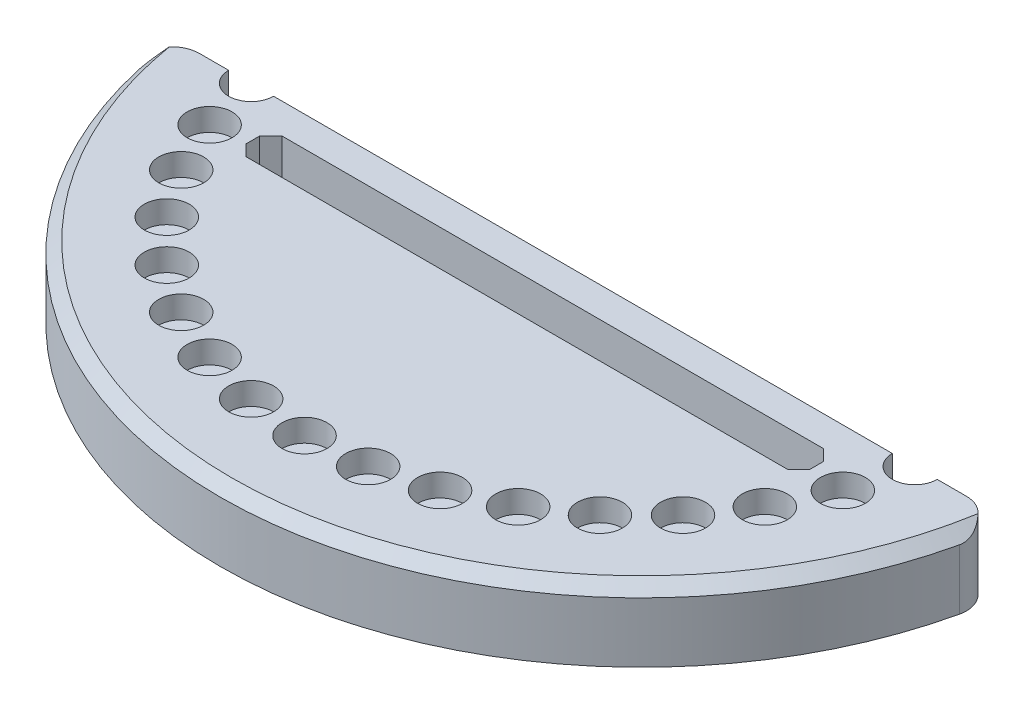
from build123d import *

# Parameters (mm, degrees)
SKETCH1_R                 = 37.5
BOSS_EXTRUDE1_DEPTH       = 6.35
SKETCH2_R                 = 2
CUT_EXTRUDE1_DEPTH        = 2
M6X1_0_TAPPED_HOLE1_D     = 5
M6X1_0_TAPPED_HOLE1_DEPTH = 15
M6X1_0_TAPPED_HOLE1_TIP   = 1.502151548
CHAMFER1_SIZE             = 1
SKETCH6_W                 = 50.2
SKETCH6_H                 = 3.2
CUT_EXTRUDE2_DEPTH        = 10
CHAMFER2_SIZE             = 1
CUT_EXTRUDE3_DEPTH        = 18
FILLET1_R                 = 2.5


with BuildPart() as part:
    # Sketch1 → Boss-Extrude1 (new body)
    with BuildSketch(Plane(origin=(0, 0, 0), x_dir=(1, 0, 0), z_dir=(0, 1, 0))):
        with Locations(Location((0, 0, 0), (0, 0, 270))):
            Circle(SKETCH1_R)
    extrude(amount=BOSS_EXTRUDE1_DEPTH)

    # Sketch2 → Cut-Extrude1 (cut)
    with BuildSketch(Plane(origin=(0, 6.35, 0), x_dir=(1, 0, 0), z_dir=(0, 1, 0))):
        with Locations(Location((0, 30, 0), (0, 0, 270))):
            Circle(SKETCH2_R)
        with Locations(Location((5.20944533, 29.54423259, 0), (0, 0, 270))):
            Circle(SKETCH2_R)
        with Locations(Location((10.2606043, 28.190778624, 0), (0, 0, 270))):
            Circle(SKETCH2_R)
        with Locations(Location((15, 25.980762114, 0), (0, 0, 270))):
            Circle(SKETCH2_R)
        with Locations(Location((19.283628291, 22.981333294, 0), (0, 0, 270))):
            Circle(SKETCH2_R)
        with Locations(Location((22.981333294, 19.283628291, 0), (0, 0, 270))):
            Circle(SKETCH2_R)
        with Locations(Location((25.980762114, 15, 0), (0, 0, 270))):
            Circle(SKETCH2_R)
        with Locations(Location((28.190778624, 10.2606043, 0), (0, 0, 270))):
            Circle(SKETCH2_R)
        with Locations(Location((29.54423259, 5.20944533, 0), (0, 0, 270))):
            Circle(SKETCH2_R)
        with Locations(Location((30, 0, 0), (0, 0, 270))):
            Circle(SKETCH2_R)
        with Locations(Location((29.54423259, -5.20944533, 0), (0, 0, 270))):
            Circle(SKETCH2_R)
        with Locations(Location((28.190778624, -10.2606043, 0), (0, 0, 270))):
            Circle(SKETCH2_R)
        with Locations(Location((25.980762114, -15, 0), (0, 0, 270))):
            Circle(SKETCH2_R)
        with Locations(Location((22.981333294, -19.283628291, 0), (0, 0, 270))):
            Circle(SKETCH2_R)
        with Locations(Location((19.283628291, -22.981333294, 0), (0, 0, 270))):
            Circle(SKETCH2_R)
        with Locations(Location((15, -25.980762114, 0), (0, 0, 270))):
            Circle(SKETCH2_R)
        with Locations(Location((10.2606043, -28.190778624, 0), (0, 0, 270))):
            Circle(SKETCH2_R)
        with Locations(Location((5.20944533, -29.54423259, 0), (0, 0, 270))):
            Circle(SKETCH2_R)
        with Locations(Location((0, -30, 0), (0, 0, 270))):
            Circle(SKETCH2_R)
        with Locations(Location((-5.20944533, -29.54423259, 0), (0, 0, 270))):
            Circle(SKETCH2_R)
        with Locations(Location((-10.2606043, -28.190778624, 0), (0, 0, 270))):
            Circle(SKETCH2_R)
        with Locations(Location((-15, -25.980762114, 0), (0, 0, 270))):
            Circle(SKETCH2_R)
        with Locations(Location((-19.283628291, -22.981333294, 0), (0, 0, 270))):
            Circle(SKETCH2_R)
        with Locations(Location((-22.981333294, -19.283628291, 0), (0, 0, 270))):
            Circle(SKETCH2_R)
        with Locations(Location((-25.980762114, -15, 0), (0, 0, 270))):
            Circle(SKETCH2_R)
        with Locations(Location((-28.190778624, -10.2606043, 0), (0, 0, 270))):
            Circle(SKETCH2_R)
        with Locations(Location((-29.54423259, -5.20944533, 0), (0, 0, 270))):
            Circle(SKETCH2_R)
        with Locations(Location((-30, 0, 0), (0, 0, 270))):
            Circle(SKETCH2_R)
        with Locations(Location((-29.54423259, 5.20944533, 0), (0, 0, 270))):
            Circle(SKETCH2_R)
        with Locations(Location((-28.190778624, 10.2606043, 0), (0, 0, 270))):
            Circle(SKETCH2_R)
        with Locations(Location((-25.980762114, 15, 0), (0, 0, 270))):
            Circle(SKETCH2_R)
        with Locations(Location((-22.981333294, 19.283628291, 0), (0, 0, 270))):
            Circle(SKETCH2_R)
        with Locations(Location((-19.283628291, 22.981333294, 0), (0, 0, 270))):
            Circle(SKETCH2_R)
        with Locations(Location((-15, 25.980762114, 0), (0, 0, 270))):
            Circle(SKETCH2_R)
        with Locations(Location((-10.2606043, 28.190778624, 0), (0, 0, 270))):
            Circle(SKETCH2_R)
        with Locations(Location((-5.20944533, 29.54423259, 0), (0, 0, 270))):
            Circle(SKETCH2_R)
    extrude(amount=-CUT_EXTRUDE1_DEPTH, mode=Mode.SUBTRACT)

    # M6x1.0 Tapped Hole1
    with Locations(Plane(origin=(0, 6.35, 0), x_dir=(1, 0, 0), z_dir=(0, 1, 0))):
        with Locations((0, 0)):
            Hole(M6X1_0_TAPPED_HOLE1_D / 2, depth=M6X1_0_TAPPED_HOLE1_DEPTH)
            with Locations((0, 0, -(M6X1_0_TAPPED_HOLE1_DEPTH + M6X1_0_TAPPED_HOLE1_TIP / 2))):  # 118° drill point
                Cone(0, M6X1_0_TAPPED_HOLE1_D / 2, M6X1_0_TAPPED_HOLE1_TIP, mode=Mode.SUBTRACT)

    # Chamfer1
    chamfer1_edges = [part.edges().sort_by_distance(p)[0] for p in [
        (0, 6.35, -37.5),
    ]]
    chamfer(chamfer1_edges, length=CHAMFER1_SIZE)

    # Sketch6 → Cut-Extrude2 (cut)
    with BuildSketch(Plane(origin=(0, 6.35, 0), x_dir=(1, 0, 0), z_dir=(0, 1, 0))):
        with Locations((0, -9.5)):
            Rectangle(SKETCH6_W, SKETCH6_H)
    extrude(amount=-CUT_EXTRUDE2_DEPTH, mode=Mode.SUBTRACT)

    # Chamfer2
    chamfer2_edges = [part.edges().sort_by_distance(p)[0] for p in [
        (25.1, 3.175, 7.9),
        (25.1, 3.175, 11.1),
        (-25.1, 3.175, 11.1),
        (-25.1, 3.175, 7.9),
    ]]
    chamfer(chamfer2_edges, length=CHAMFER2_SIZE)

    # Sketch7 → Cut-Extrude3 (cut)
    with BuildSketch(Plane(origin=(0, 6.35, 0), x_dir=(1, 0, 0), z_dir=(0, 1, 0))):
        Polygon((-45.405269777, -5.20944533), (48.202750853, -5.20944533), (48.202750853, 45.076127107), (-45.405269777, 43.569791143), align=None)
    extrude(amount=-CUT_EXTRUDE3_DEPTH, mode=Mode.SUBTRACT)

    # Fillet1
    fillet1_edges = [part.edges().sort_by_distance(p)[0] for p in [
        (37.136392923, 2.675, 5.20944533),
        (-37.136392923, 2.675, 5.20944533),
    ]]
    fillet(fillet1_edges, radius=FILLET1_R)


solid = part.part
